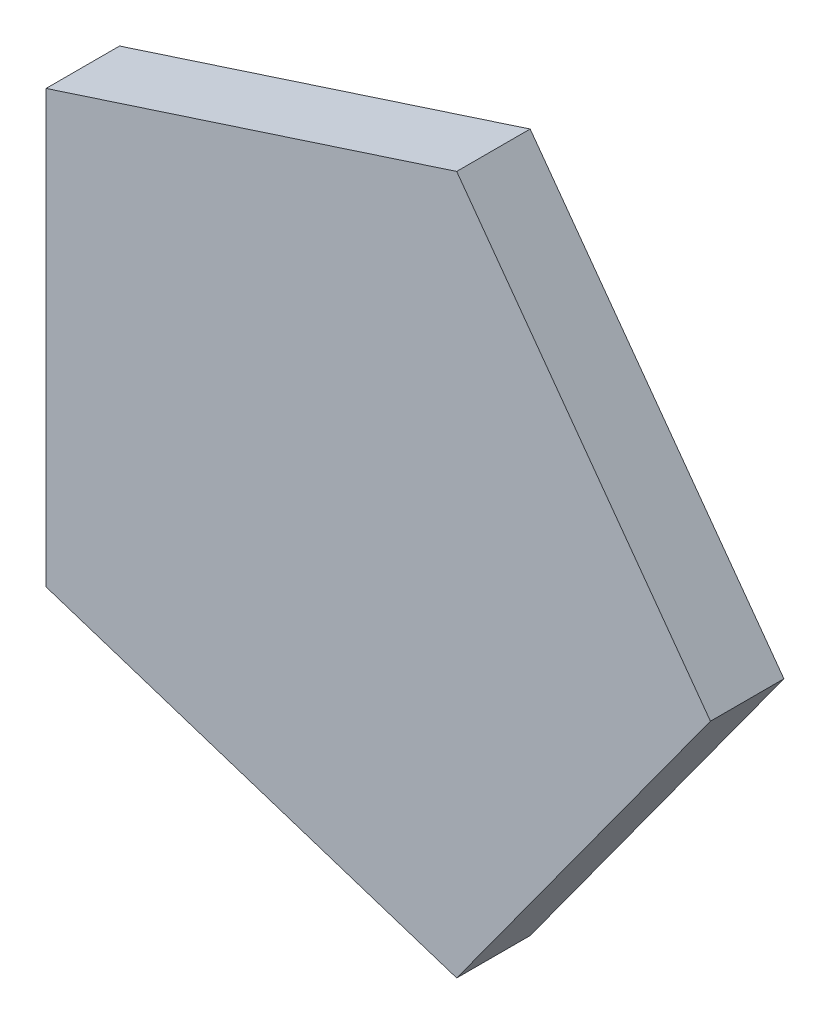
from build123d import *

# Parameters (mm, degrees)
EXTRUDE_1_DEPTH = 20


with BuildPart() as part:
    # 草图1 → 凸台-拉伸1 (new body)
    with BuildSketch(Plane.XY):
        Polygon((100, 0), (30.901699437, 95.10565163), (-80.901699437, 58.778525229), (-80.901699437, -58.778525229), (30.901699437, -95.10565163), align=None)
    extrude(amount=EXTRUDE_1_DEPTH)


solid = part.part
